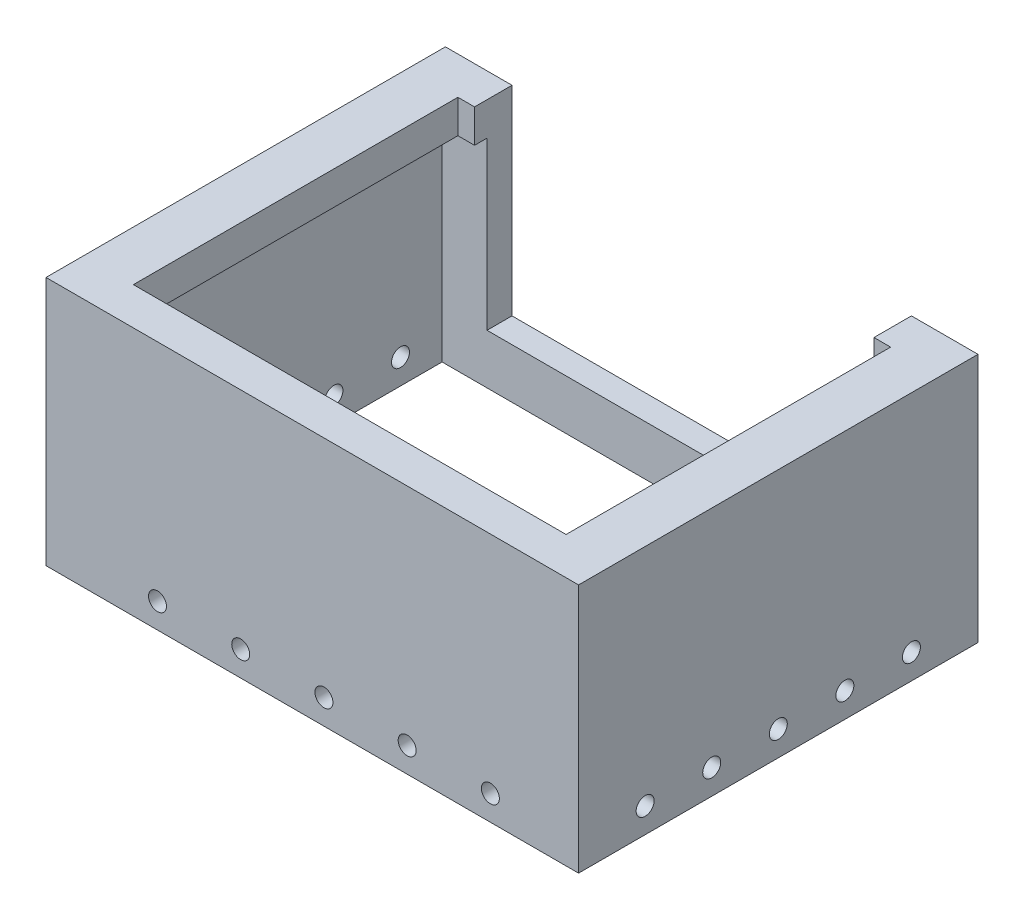
from build123d import *

# Parameters (mm, degrees)
BOSS_EXTRUDE1_DEPTH = 10
BOSS_EXTRUDE2_DEPTH = 65
SKETCH5_R           = 2.7
M5HOLES_DEPTH       = 231.341689519
SKETCH6_R           = 2.7
M5_HOLES_DEPTH      = 25
SKETCH7_W           = 7.5
SKETCH7_H           = 15
BOSS_EXTRUDE3_DEPTH = 121


with BuildPart() as part:
    # Sketch1 → Boss-Extrude1 (new body)
    with BuildSketch(Plane(origin=(0, 0, 0), x_dir=(1, 0, 0), z_dir=(0, 1, 0))):
        Polygon((-142.5, 141.171435272), (-142.5, 152.421435272), (-162.5, 152.421435272), (-162.5, 32.421435272), (-2.5, 32.421435272), (-2.5, 152.421435272), (-22.5, 152.421435272), (-22.5, 141.171435272), (-17.5, 141.171435272), (-17.5, 43.671435272), (-147.5, 43.671435272), (-147.5, 141.171435272), align=None)
    extrude(amount=BOSS_EXTRUDE1_DEPTH)

    # Sketch2 → Boss-Extrude2 (add)
    with BuildSketch(Plane.XZ):
        Polygon((-156, -144.921435272), (-156, -39.921435272), (-9, -39.921435272), (-9, -144.921435272), (-22.5, -144.921435272), (-22.5, -152.421435272), (-2.5, -152.421435272), (-2.5, -32.421435272), (-162.5, -32.421435272), (-162.5, -152.421435272), (-142.5, -152.421435272), (-142.5, -144.921435272), align=None)
    extrude(amount=BOSS_EXTRUDE2_DEPTH)

    # Sketch5 → M5holes (cut, through all)
    with BuildSketch(Plane.ZY.offset(162.5)):
        with Locations((-132.421435272, -57.5)):
            Circle(SKETCH5_R)
        with Locations((-112.421435272, -57.5)):
            Circle(SKETCH5_R)
        with Locations((-92.421435272, -57.5)):
            Circle(SKETCH5_R)
        with Locations((-72.421435272, -57.5)):
            Circle(SKETCH5_R)
        with Locations((-52.421435272, -57.5)):
            Circle(SKETCH5_R)
    extrude(amount=-M5HOLES_DEPTH, mode=Mode.SUBTRACT)

    # Sketch6 → M5_holes (cut)
    with BuildSketch(Plane(origin=(0, 0, -39.921435272), x_dir=(-1, 0, 0), z_dir=(0, 0, -1))):
        with Locations((29, -57.5)):
            Circle(SKETCH6_R)
        with Locations((54, -57.5)):
            Circle(SKETCH6_R)
        with Locations((79, -57.5)):
            Circle(SKETCH6_R)
        with Locations((104, -57.5)):
            Circle(SKETCH6_R)
        with Locations((129, -57.5)):
            Circle(SKETCH6_R)
    extrude(amount=-M5_HOLES_DEPTH, mode=Mode.SUBTRACT)

    # Sketch7 → Boss-Extrude3 (add)
    with BuildSketch(Plane.ZY.offset(22.5)):
        with Locations((-148.671435272, -57.5)):
            Rectangle(SKETCH7_W, SKETCH7_H)
    extrude(amount=BOSS_EXTRUDE3_DEPTH)


solid = part.part
